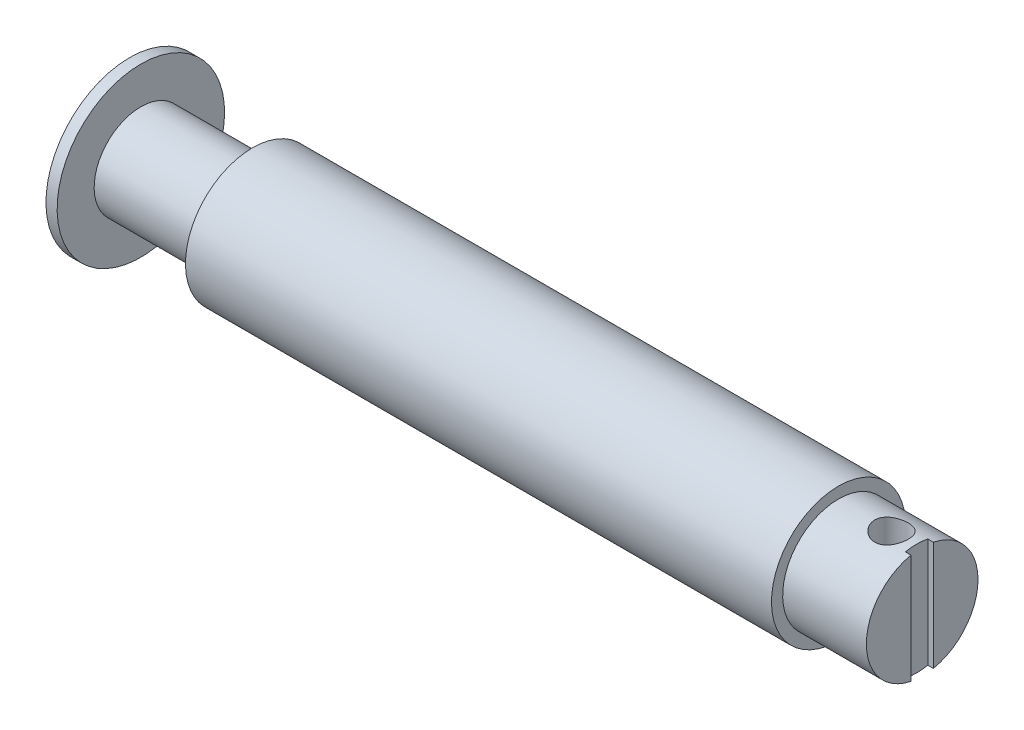
from build123d import *
from build123d.topology import SkipClean

# Parameters (mm, degrees)
ESQUISSE2_R             = 10
EXTRUSION1_DEPTH        = 15
ENL_V_START             = -1
ENL_V_MAT_EXTRU_1_DEPTH = 1
EXTRUSION2_DEPTH        = 1
ESQUISSE5_W             = 3
ESQUISSE5_H             = 20


with BuildPart() as part:
    # Esquisse1 → Révolution1 (revolve)
    with BuildSketch(Plane.XY):
        Polygon((-54, 15), (-54, 0), (73, 0), (73, 12), (-32, 12), (-32, 8.364637375), (-52, 8.364637375), (-52, 15), align=None)
    revolve(axis=Axis((-54, 0, 0), (1, 0, 0)))

    # Esquisse2 → Extrusion1 (add)
    with BuildSketch(Plane(origin=(73, 0, 0), x_dir=(0, 0, -1), z_dir=(1, 0, 0))):
        with Locations(Location((0, 0, 0), (0, 0, 90))):
            Circle(ESQUISSE2_R)
    extrude(amount=EXTRUSION1_DEPTH)

    # Esquisse3 → Enlèv. mat.-Extru.1 (cut)
    with BuildSketch(Plane(origin=(88, 0, 0), x_dir=(0, 0, -1), z_dir=(1, 0, 0)).offset(ENL_V_START)):
        with BuildLine():
            Line((2, -9.797958971), (2, 9.797958971))
            ThreePointArc((2, 9.797958971), (-10, 0), (2, -9.797958971))
        make_face()
    extrude(amount=ENL_V_MAT_EXTRU_1_DEPTH, mode=Mode.SUBTRACT)

    # Esquisse4 → Extrusion2 (add)
    with SkipClean():  # the faces are left unmerged after this step: merging them gives an invalid solid
        with BuildSketch(Plane(origin=(87, 0, 0), x_dir=(0, 0, -1), z_dir=(1, 0, 0))):
            with BuildLine():
                Line((-2, 9.797958971), (-2, -9.797958971))
                ThreePointArc((-2, -9.797958971), (-10, 0), (-2, 9.797958971))
            make_face()
        extrude(amount=EXTRUSION2_DEPTH)

    # Esquisse5 → Enlèvement de matière-Révolution1 (revolve, cut)
    with BuildSketch(Plane.XY, mode=Mode.PRIVATE) as enl_vement_de_mati_re_r_volution1_sk:
        with Locations((81, 0)):
            Rectangle(ESQUISSE5_W, ESQUISSE5_H)
    revolve(enl_vement_de_mati_re_r_volution1_sk.sketch.rotate(Axis((82.5, -10, 0), (0, 1, 0)), 90), axis=Axis((82.5, -10, 0), (0, 1, 0)), mode=Mode.SUBTRACT)


solid = part.part
